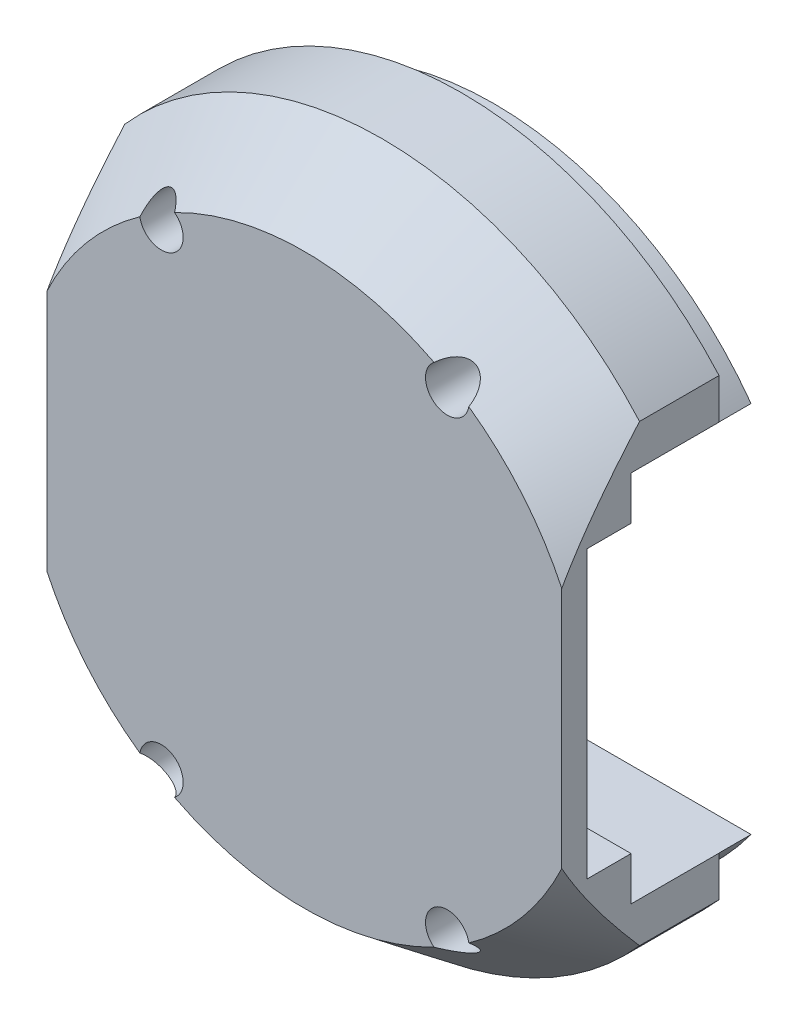
from build123d import *

# Parameters (mm, degrees)
EXTRUDE1_DEPTH     = 2.25
EXTRUDE2_DEPTH     = 11
CHAMFER1_SIZE      = 4.1
CHAMFER1_SIZE2     = 5.440883769
SKETCH6_W          = 60
SKETCH6_H          = 26.1
CUT_EXTRUDE1_DEPTH = 8.4
SKETCH9_W          = 10
SKETCH9_H          = 40
CUT_EXTRUDE3_DEPTH = 37.143991781
SKETCH10_W         = 44
SKETCH10_H         = 20
CUT_EXTRUDE4_DEPTH = 3.1
CUT_EXTRUDE8_REACH = 34.796
SKETCH16_R         = 1.525
CUT_EXTRUDE9_DEPTH = 33.795769544


with BuildPart() as part:
    # Sketch1 → Extrude1 (new body)
    with BuildSketch(Plane.XY):
        with BuildLine():
            ThreePointArc((-22.224984725, -0.026057486), (0.013028745, -22.224996181), (22.225, 0))
            ThreePointArc((22.225, 0), (-0.013028745, 22.224996181), (-22.224984725, -0.026057486))
        make_face()
    extrude(amount=EXTRUDE1_DEPTH)

    # Sketch2 → Extrude2 (add)
    with BuildSketch(Plane.XY.offset(2.25)):
        with BuildLine():
            ThreePointArc((-23.999872331, -0.078282234), (0.113586787, -23.999731208), (23.999538151, 0.148891095))
            ThreePointArc((23.999538151, 0.148891095), (-0.113586787, 23.999731208), (-23.999872331, -0.078282234))
        make_face()
    extrude(amount=EXTRUDE2_DEPTH)

    # Chamfer1
    chamfer1_edges = [part.edges().sort_by_distance(p)[0] for p in [
        (-23.999538151, -0.148891095, 13.25),
    ]]
    chamfer1_side = [part.faces().sort_by_distance(p)[0] for p in [
        (0, 0, 13.25),
    ]]
    chamfer(chamfer1_edges, length=CHAMFER1_SIZE, length2=CHAMFER1_SIZE2, reference=chamfer1_side[0])

    # Sketch6 → Cut-Extrude1 (cut)
    with BuildSketch(Plane(origin=(0, 0, 0), x_dir=(-1, 0, 0), z_dir=(0, 0, -1))):
        Rectangle(SKETCH6_W, SKETCH6_H)
    extrude(amount=-CUT_EXTRUDE1_DEPTH, mode=Mode.SUBTRACT)

    # Sketch9 → Cut-Extrude3 (cut, through all)
    with BuildSketch(Plane(origin=(0, 0, 0), x_dir=(-1, 0, 0), z_dir=(0, 0, -1))):
        with Locations((-23, 0)):
            Rectangle(SKETCH9_W, SKETCH9_H)
        with Locations((23, 0)):
            Rectangle(SKETCH9_W, SKETCH9_H)
    extrude(amount=-CUT_EXTRUDE3_DEPTH, mode=Mode.SUBTRACT)

    # Sketch10 → Cut-Extrude4 (cut)
    with BuildSketch(Plane(origin=(0, 0, 8.4), x_dir=(-1, 0, 0), z_dir=(0, 0, -1))):
        Rectangle(SKETCH10_W, SKETCH10_H)
    extrude(amount=-CUT_EXTRUDE4_DEPTH, mode=Mode.SUBTRACT)

    # Cut-Extrude8: up to this face of the body (flat: up to its plane)
    cut_extrude8_end = Plane(part.part.faces().sort_by_distance((0, 0, 11.5))[0])
    # Sketch15 → Cut-Extrude8 (cut, up to the picked face)
    with BuildSketch(Plane(origin=(0, 0, 0), x_dir=(-1, 0, 0), z_dir=(0, 0, -1)), mode=Mode.PRIVATE) as cut_extrude8_sk1:
        with BuildLine():
            Line((6, -13), (6, 13))
            ThreePointArc((6, 13), (0, 19), (-6, 13))
            Line((-6, 13), (-6, -13))
            ThreePointArc((-6, -13), (0, -19), (6, -13))
        make_face()
    cut_extrude8_tool1 = split(extrude(cut_extrude8_sk1.sketch, amount=-CUT_EXTRUDE8_REACH, mode=Mode.PRIVATE), bisect_by=cut_extrude8_end, keep=Keep.BOTH, mode=Mode.PRIVATE)
    add(cut_extrude8_tool1.solids().sort_by(Axis((0, 0, 0), (0, 0, 1)))[0], mode=Mode.SUBTRACT)

    # Sketch16 → Cut-Extrude9 (cut, through all)
    with BuildSketch(Plane(origin=(0, 0, 0), x_dir=(-1, 0, 0), z_dir=(0, 0, -1))):
        with Locations((-10, -16.5)):
            Circle(SKETCH16_R)
        with Locations(Location((10, -16.5, 0), (0, 0, 9.857274388))):
            Circle(SKETCH16_R)
        with Locations((10, 16.5)):
            Circle(SKETCH16_R)
        with Locations(Location((-10, 16.5, 0), (0, 0, 52.579530574))):
            Circle(SKETCH16_R)
    extrude(amount=-CUT_EXTRUDE9_DEPTH, mode=Mode.SUBTRACT)


solid = part.part
